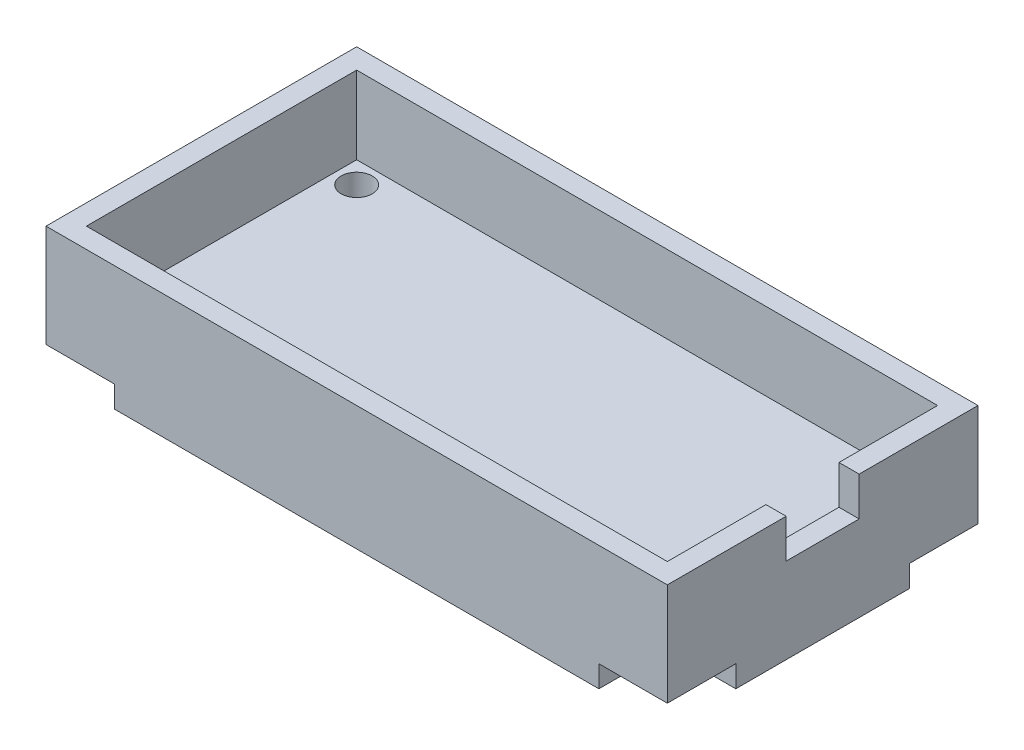
from build123d import *

# Parameters (mm, degrees)
ESQUISSE1_W             = 40
ESQUISSE1_H             = 8
EXTRUSION1_DEPTH        = 10
ESQUISSE2_W             = 37.4
ESQUISSE2_H             = 17.4
ENL_V_MAT_EXTRU_1_DEPTH = 5
ESQUISSE3_W             = 1.3
ESQUISSE3_H             = 4.7
ENL_V_MAT_EXTRU_2_DEPTH = 2.5
ESQUISSE4_R             = 1
ENL_V_MAT_EXTRU_3_DEPTH = 43
ENL_V_MAT_EXTRU_4_DEPTH = 1.4


with BuildPart() as part:
    # Esquisse1 → Extrusion1 (new, symmetric)
    with BuildSketch(Plane.XY):
        with Locations((20, 4)):
            Rectangle(ESQUISSE1_W, ESQUISSE1_H)
    extrude(amount=EXTRUSION1_DEPTH, both=True)

    # Esquisse2 → Enlèv. mat.-Extru.1 (cut)
    with BuildSketch(Plane(origin=(0, 8, 0), x_dir=(-1, 0, 0), z_dir=(0, 1, 0))):
        with Locations((-20, 0)):
            Rectangle(ESQUISSE2_W, ESQUISSE2_H)
    extrude(amount=-ENL_V_MAT_EXTRU_1_DEPTH, mode=Mode.SUBTRACT)

    # Esquisse3 → Enlèv. mat.-Extru.2 (cut)
    with BuildSketch(Plane(origin=(0, 8, 0), x_dir=(-1, 0, 0), z_dir=(0, 1, 0))):
        with Locations((-39.35, 0)):
            Rectangle(ESQUISSE3_W, ESQUISSE3_H)
    extrude(amount=-ENL_V_MAT_EXTRU_2_DEPTH, mode=Mode.SUBTRACT)

    # Esquisse4 → Enlèv. mat.-Extru.3 (cut, through all)
    with BuildSketch(Plane.XZ):
        with Locations(Location((37.3, 7.3, 0), (0, 0, 270))):
            Circle(ESQUISSE4_R)
        with Locations(Location((37.3, -7.3, 0), (0, 0, 270))):
            Circle(ESQUISSE4_R)
        with Locations(Location((2.7, -7.3, 0), (0, 0, 270))):
            Circle(ESQUISSE4_R)
        with Locations(Location((2.7, 7.3, 0), (0, 0, 270))):
            Circle(ESQUISSE4_R)
    extrude(amount=-ENL_V_MAT_EXTRU_3_DEPTH, mode=Mode.SUBTRACT)

    # Esquisse5 → Enlèv. mat.-Extru.4 (cut)
    with BuildSketch(Plane.XZ):
        with BuildLine():
            Line((40, -5.592893219), (36.592893219, -5.592893219))
            ThreePointArc((36.592893219, -5.592893219), (35.885786438, -5.885786438), (35.592893219, -6.592893219))
            Line((35.592893219, -6.592893219), (35.592893219, -10))
            Line((35.592893219, -10), (40, -10))
            Line((40, -10), (40, -5.592893219))
        make_face()
        with BuildLine():
            Line((40, 10), (40, 5.592893219))
            Line((40, 5.592893219), (36.592893219, 5.592893219))
            ThreePointArc((36.592893219, 5.592893219), (35.885786438, 5.885786438), (35.592893219, 6.592893219))
            Line((35.592893219, 6.592893219), (35.592893219, 10))
            Line((35.592893219, 10), (40, 10))
        make_face()
        with BuildLine():
            Line((0, 5.592893219), (3.407106781, 5.592893219))
            ThreePointArc((3.407106781, 5.592893219), (4.114213562, 5.885786438), (4.407106781, 6.592893219))
            Line((4.407106781, 6.592893219), (4.407106781, 10))
            Line((4.407106781, 10), (0, 10))
            Line((0, 10), (0, 5.592893219))
        make_face()
        with BuildLine():
            Line((0, -10), (0, -5.592893219))
            Line((0, -5.592893219), (3.407106781, -5.592893219))
            ThreePointArc((3.407106781, -5.592893219), (4.114213562, -5.885786438), (4.407106781, -6.592893219))
            Line((4.407106781, -6.592893219), (4.407106781, -10))
            Line((4.407106781, -10), (0, -10))
        make_face()
    extrude(amount=-ENL_V_MAT_EXTRU_4_DEPTH, mode=Mode.SUBTRACT)


solid = part.part
